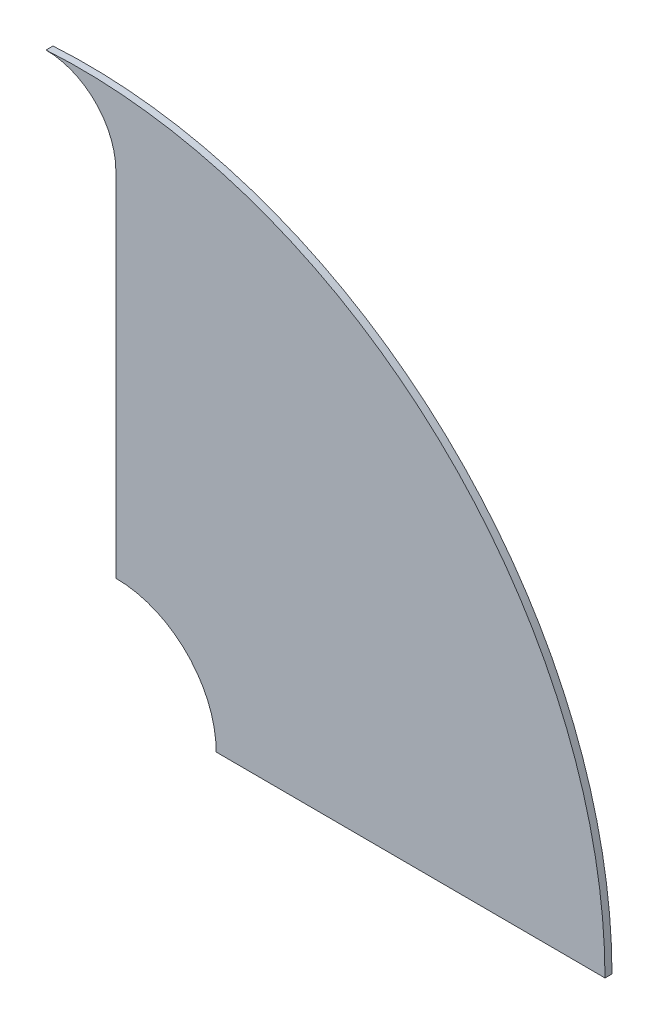
from build123d import *

# Parameters (mm, degrees)
BOSS_EXTRUDE2_DEPTH = 10


with BuildPart() as part:
    # Sketch1 → Boss-Extrude2 (new body)
    with BuildSketch(Plane.XY):
        with BuildLine():
            Line((946.568769473, -612.108653834), (946.568769473, -1116.807153033))
            ThreePointArc((946.568769473, -1116.807153033), (1048.115870255, -1158.869339396), (1090.178056619, -1260.416440178))
            Line((1090.178056619, -1260.416440178), (1646.568769473, -1262.242939545))
            ThreePointArc((1646.568769473, -1262.242939545), (1409.039966295, -713.90421061), (846.568769473, -512.108653834))
            ThreePointArc((846.568769473, -512.108653834), (917.279447592, -541.397975715), (946.568769473, -612.108653834))
        make_face()
    extrude(amount=-BOSS_EXTRUDE2_DEPTH)


solid = part.part
